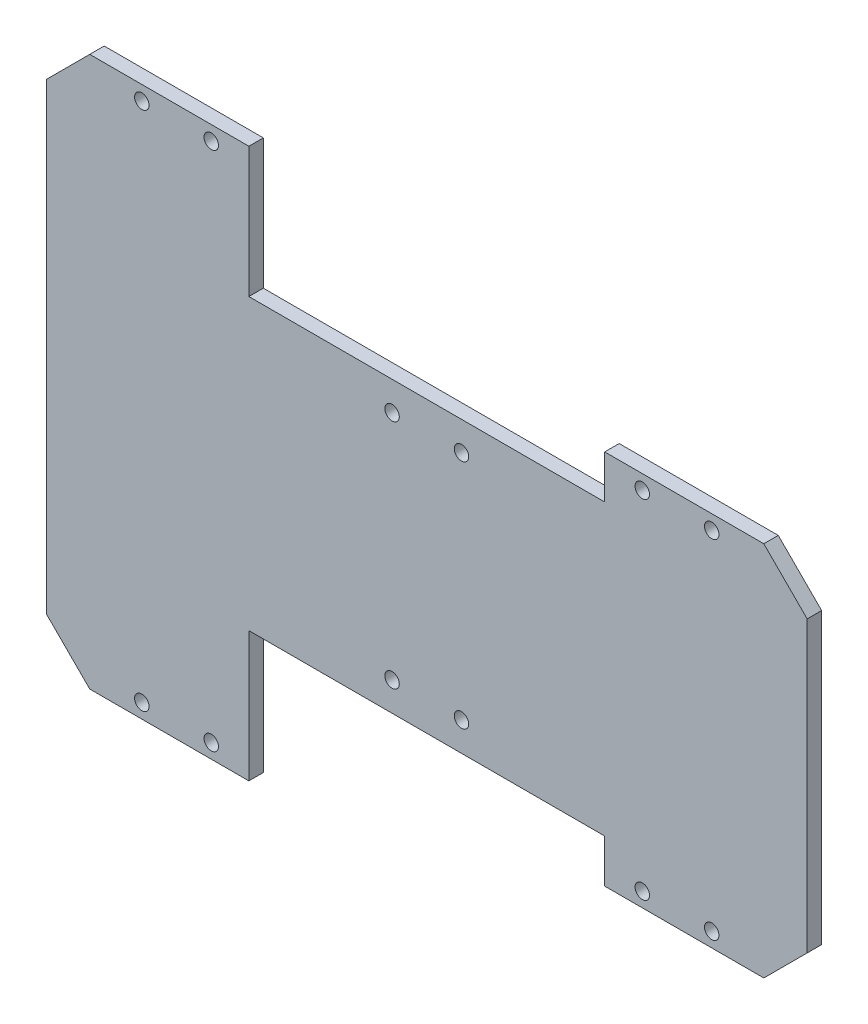
from build123d import *

# Parameters (mm, degrees)
SKETCH_1_R      = 2.5
EXTRUDE_1_DEPTH = 5


with BuildPart() as part:
    # 草图1 → 凸台-拉伸1 (new body)
    with BuildSketch(Plane.XY.offset(5)):
        Polygon((50.930030436, -59.99999996), (50.930030436, 39.999999938), (35.930030436, 54.999999938), (-19.069969566, 54.999999938), (-19.069969566, 39.999999989), (-142.069969574, 39.999999989), (-142.069969574, 84.999999989), (-197.069969604, 84.999999989), (-212.069969578, 70.000000014), (-212.069969578, -90.000000037), (-197.069969604, -105.000000011), (-142.069969574, -105.000000011), (-142.069969574, -60.000000011), (-19.069969566, -60.000000011), (-19.069969566, -74.99999996), (35.930030436, -74.99999996), align=None)
        with Locations((-179.069969574, 79.999999989)):
            Circle(SKETCH_1_R, mode=Mode.SUBTRACT)
        with Locations(Location((-6.069969566, 49.999999938, 0), (0, 0, 180))):
            Circle(SKETCH_1_R, mode=Mode.SUBTRACT)
        with Locations(Location((-155.069969574, 79.999999989, 0), (0, 0, 180))):
            Circle(SKETCH_1_R, mode=Mode.SUBTRACT)
        with Locations(Location((-92.569969578, 30.000000012, 0), (0, 0, 180))):
            Circle(SKETCH_1_R, mode=Mode.SUBTRACT)
        with Locations(Location((-68.569969578, 30, 0), (0, 0, 180))):
            Circle(SKETCH_1_R, mode=Mode.SUBTRACT)
        with Locations((17.930030434, 49.999999938)):
            Circle(SKETCH_1_R, mode=Mode.SUBTRACT)
        with Locations(Location((17.930030434, -69.99999996, 0), (0, 0, 180))):
            Circle(SKETCH_1_R, mode=Mode.SUBTRACT)
        with Locations((-68.569969578, -50.000000023)):
            Circle(SKETCH_1_R, mode=Mode.SUBTRACT)
        with Locations((-92.569969578, -50.000000034)):
            Circle(SKETCH_1_R, mode=Mode.SUBTRACT)
        with Locations((-155.069969574, -100.000000011)):
            Circle(SKETCH_1_R, mode=Mode.SUBTRACT)
        with Locations((-6.069969566, -69.99999996)):
            Circle(SKETCH_1_R, mode=Mode.SUBTRACT)
        with Locations(Location((-179.069969574, -100.000000011, 0), (0, 0, 180))):
            Circle(SKETCH_1_R, mode=Mode.SUBTRACT)
    extrude(amount=-EXTRUDE_1_DEPTH)


solid = part.part
